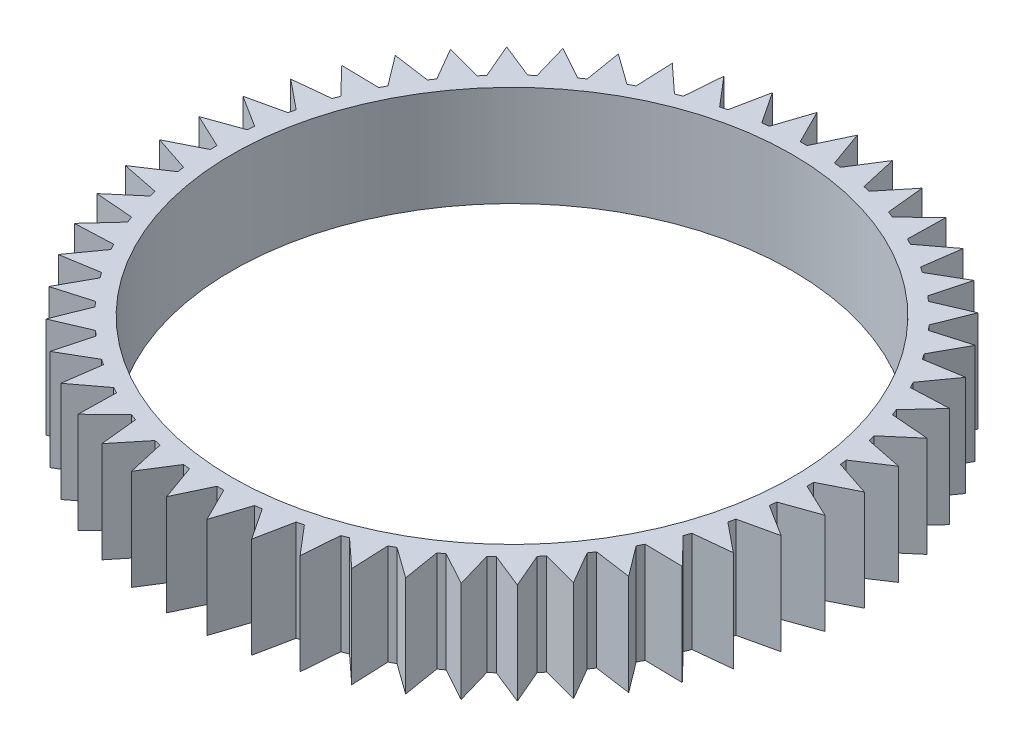
from build123d import *

# Parameters (mm, degrees)
SKETCH1_R           = 22.25
BOSS_EXTRUDE1_DEPTH = 8


with BuildPart() as part:
    # Sketch1 → Boss-Extrude1 (new body)
    with BuildSketch(Plane(origin=(0, 0, 0), x_dir=(1, 0, 0), z_dir=(0, 1, 0))):
        with BuildLine():
            Line((0, 23.45), (1.282365767, 26.162109518))
            Line((1.282365767, 26.162109518), (2.293347269, 23.337588957))
            ThreePointArc((2.293347269, 23.337588957), (2.560133686, 23.309830877), (2.826585152, 23.279023098))
            Line((2.826585152, 23.279023098), (4.426509707, 25.816786171))
            Line((4.426509707, 25.816786171), (5.089661683, 22.890999191))
            ThreePointArc((5.089661683, 22.890999191), (5.35115706, 22.83128595), (5.611952328, 22.768585619))
            Line((5.611952328, 22.768585619), (7.506105167, 25.094995948))
            Line((7.506105167, 25.094995948), (7.811757369, 22.110607111))
            ThreePointArc((7.811757369, 22.110607111), (8.064148514, 22.019809462), (8.315484601, 21.926130891))
            Line((8.315484601, 21.926130891), (10.476244712, 24.007264174))
            Line((10.476244712, 24.007264174), (10.419940042, 21.00779259))
            ThreePointArc((10.419940042, 21.00779259), (10.659546525, 20.887234568), (10.897758384, 20.763943802))
            Line((10.897758384, 20.763943802), (13.293617018, 22.56945243))
            Line((13.293617018, 22.56945243), (12.876176526, 19.598637148))
            ThreePointArc((12.876176526, 19.598637148), (13.099504343, 19.45007676), (13.321118311, 19.298971655))
            Line((13.321118311, 19.298971655), (15.917138454, 20.802527246))
            Line((15.917138454, 20.802527246), (15.144649361, 17.903689445))
            ThreePointArc((15.144649361, 17.903689445), (15.348441891, 17.729293035), (15.550226336, 17.552577045))
            Line((15.550226336, 17.552577045), (18.308552169, 18.732254373))
            Line((18.308552169, 18.732254373), (17.192279106, 15.947665633))
            ThreePointArc((17.192279106, 15.947665633), (17.373564595, 15.749976294), (17.552577045, 15.550226336))
            Line((17.552577045, 15.550226336), (20.432985966, 16.388823049))
            Line((20.432985966, 16.388823049), (18.989206708, 13.759088946))
            ThreePointArc((18.989206708, 13.759088946), (19.145341605, 13.540989434), (19.298971655, 13.321118311))
            Line((19.298971655, 13.321118311), (22.259460816, 13.806405781))
            Line((22.259460816, 13.806405781), (20.509228916, 11.369873759))
            ThreePointArc((20.509228916, 11.369873759), (20.637936422, 11.134544456), (20.763943802, 10.897758384))
            Line((20.763943802, 10.897758384), (23.761342604, 11.022660027))
            Line((23.761342604, 11.022660027), (21.730180383, 8.81486021))
            ThreePointArc((21.730180383, 8.81486021), (21.829583654, 8.565732746), (21.926130891, 8.315484601))
            Line((21.926130891, 8.315484601), (24.916730511, 8.078179069))
            Line((24.916730511, 8.078179069), (22.634256889, 6.131306149))
            ThreePointArc((22.634256889, 6.131306149), (22.702906401, 5.872013366), (22.768585619, 5.611952328))
            Line((22.768585619, 5.611952328), (25.708776379, 5.01590007))
            Line((25.708776379, 5.01590007), (23.208274961, 3.358343839))
            ThreePointArc((23.208274961, 3.358343839), (23.245169649, 3.092666807), (23.279023098, 2.826585152))
            Line((23.279023098, 2.826585152), (26.125930396, 1.880477953))
            Line((26.125930396, 1.880477953), (23.443864124, 0.536409313))
            ThreePointArc((23.443864124, 0.536409313), (23.448465981, 0.268222203), (23.45, 0))
            Line((23.45, 0), (26.162109518, -1.282365767))
            Line((26.162109518, -1.282365767), (23.337588957, -2.293347269))
            ThreePointArc((23.337588957, -2.293347269), (23.309830877, -2.560133686), (23.279023098, -2.826585152))
            Line((23.279023098, -2.826585152), (25.816786171, -4.426509707))
            Line((25.816786171, -4.426509707), (22.890999191, -5.089661683))
            ThreePointArc((22.890999191, -5.089661683), (22.83128595, -5.35115706), (22.768585619, -5.611952328))
            Line((22.768585619, -5.611952328), (25.094995948, -7.506105167))
            Line((25.094995948, -7.506105167), (22.110607111, -7.811757369))
            ThreePointArc((22.110607111, -7.811757369), (22.019809462, -8.064148514), (21.926130891, -8.315484601))
            Line((21.926130891, -8.315484601), (24.007264174, -10.476244712))
            Line((24.007264174, -10.476244712), (21.00779259, -10.419940042))
            ThreePointArc((21.00779259, -10.419940042), (20.887234568, -10.659546525), (20.763943802, -10.897758384))
            Line((20.763943802, -10.897758384), (22.56945243, -13.293617018))
            Line((22.56945243, -13.293617018), (19.598637148, -12.876176526))
            ThreePointArc((19.598637148, -12.876176526), (19.45007676, -13.099504343), (19.298971655, -13.321118311))
            Line((19.298971655, -13.321118311), (20.802527246, -15.917138454))
            Line((20.802527246, -15.917138454), (17.903689445, -15.144649361))
            ThreePointArc((17.903689445, -15.144649361), (17.729293035, -15.348441891), (17.552577045, -15.550226336))
            Line((17.552577045, -15.550226336), (18.732254373, -18.308552169))
            Line((18.732254373, -18.308552169), (15.947665633, -17.192279106))
            ThreePointArc((15.947665633, -17.192279106), (15.749976294, -17.373564595), (15.550226336, -17.552577045))
            Line((15.550226336, -17.552577045), (16.388823049, -20.432985966))
            Line((16.388823049, -20.432985966), (13.759088946, -18.989206708))
            ThreePointArc((13.759088946, -18.989206708), (13.540989434, -19.145341605), (13.321118311, -19.298971655))
            Line((13.321118311, -19.298971655), (13.806405781, -22.259460816))
            Line((13.806405781, -22.259460816), (11.369873759, -20.509228916))
            ThreePointArc((11.369873759, -20.509228916), (11.134544456, -20.637936422), (10.897758384, -20.763943802))
            Line((10.897758384, -20.763943802), (11.022660027, -23.761342604))
            Line((11.022660027, -23.761342604), (8.81486021, -21.730180383))
            ThreePointArc((8.81486021, -21.730180383), (8.565732746, -21.829583654), (8.315484601, -21.926130891))
            Line((8.315484601, -21.926130891), (8.078179069, -24.916730511))
            Line((8.078179069, -24.916730511), (6.131306149, -22.634256889))
            ThreePointArc((6.131306149, -22.634256889), (5.872013366, -22.702906401), (5.611952328, -22.768585619))
            Line((5.611952328, -22.768585619), (5.01590007, -25.708776379))
            Line((5.01590007, -25.708776379), (3.358343839, -23.208274961))
            ThreePointArc((3.358343839, -23.208274961), (3.092666807, -23.245169649), (2.826585152, -23.279023098))
            Line((2.826585152, -23.279023098), (1.880477953, -26.125930396))
            Line((1.880477953, -26.125930396), (0.536409313, -23.443864124))
            ThreePointArc((0.536409313, -23.443864124), (0.268222203, -23.448465981), (0, -23.45))
            Line((0, -23.45), (-1.282365767, -26.162109518))
            Line((-1.282365767, -26.162109518), (-2.293347269, -23.337588957))
            ThreePointArc((-2.293347269, -23.337588957), (-2.560133686, -23.309830877), (-2.826585152, -23.279023098))
            Line((-2.826585152, -23.279023098), (-4.426509707, -25.816786171))
            Line((-4.426509707, -25.816786171), (-5.089661683, -22.890999191))
            ThreePointArc((-5.089661683, -22.890999191), (-5.35115706, -22.83128595), (-5.611952328, -22.768585619))
            Line((-5.611952328, -22.768585619), (-7.506105167, -25.094995948))
            Line((-7.506105167, -25.094995948), (-7.811757369, -22.110607111))
            ThreePointArc((-7.811757369, -22.110607111), (-8.064148514, -22.019809462), (-8.315484601, -21.926130891))
            Line((-8.315484601, -21.926130891), (-10.476244712, -24.007264174))
            Line((-10.476244712, -24.007264174), (-10.419940042, -21.00779259))
            ThreePointArc((-10.419940042, -21.00779259), (-10.659546525, -20.887234568), (-10.897758384, -20.763943802))
            Line((-10.897758384, -20.763943802), (-13.293617018, -22.56945243))
            Line((-13.293617018, -22.56945243), (-12.876176526, -19.598637148))
            ThreePointArc((-12.876176526, -19.598637148), (-13.099504343, -19.45007676), (-13.321118311, -19.298971655))
            Line((-13.321118311, -19.298971655), (-15.917138454, -20.802527246))
            Line((-15.917138454, -20.802527246), (-15.144649361, -17.903689445))
            ThreePointArc((-15.144649361, -17.903689445), (-15.348441891, -17.729293035), (-15.550226336, -17.552577045))
            Line((-15.550226336, -17.552577045), (-18.308552169, -18.732254373))
            Line((-18.308552169, -18.732254373), (-17.192279106, -15.947665633))
            ThreePointArc((-17.192279106, -15.947665633), (-17.373564595, -15.749976294), (-17.552577045, -15.550226336))
            Line((-17.552577045, -15.550226336), (-20.432985966, -16.388823049))
            Line((-20.432985966, -16.388823049), (-18.989206708, -13.759088946))
            ThreePointArc((-18.989206708, -13.759088946), (-19.145341605, -13.540989434), (-19.298971655, -13.321118311))
            Line((-19.298971655, -13.321118311), (-22.259460816, -13.806405781))
            Line((-22.259460816, -13.806405781), (-20.509228916, -11.369873759))
            ThreePointArc((-20.509228916, -11.369873759), (-20.637936422, -11.134544456), (-20.763943802, -10.897758384))
            Line((-20.763943802, -10.897758384), (-23.761342604, -11.022660027))
            Line((-23.761342604, -11.022660027), (-21.730180383, -8.81486021))
            ThreePointArc((-21.730180383, -8.81486021), (-21.829583654, -8.565732746), (-21.926130891, -8.315484601))
            Line((-21.926130891, -8.315484601), (-24.916730511, -8.078179069))
            Line((-24.916730511, -8.078179069), (-22.634256889, -6.131306149))
            ThreePointArc((-22.634256889, -6.131306149), (-22.702906401, -5.872013366), (-22.768585619, -5.611952328))
            Line((-22.768585619, -5.611952328), (-25.708776379, -5.01590007))
            Line((-25.708776379, -5.01590007), (-23.208274961, -3.358343839))
            ThreePointArc((-23.208274961, -3.358343839), (-23.245169649, -3.092666807), (-23.279023098, -2.826585152))
            Line((-23.279023098, -2.826585152), (-26.125930396, -1.880477953))
            Line((-26.125930396, -1.880477953), (-23.443864124, -0.536409313))
            ThreePointArc((-23.443864124, -0.536409313), (-23.448465981, -0.268222203), (-23.45, 0))
            Line((-23.45, 0), (-26.162109518, 1.282365767))
            Line((-26.162109518, 1.282365767), (-23.337588957, 2.293347269))
            ThreePointArc((-23.337588957, 2.293347269), (-23.309830877, 2.560133686), (-23.279023098, 2.826585152))
            Line((-23.279023098, 2.826585152), (-25.816786171, 4.426509707))
            Line((-25.816786171, 4.426509707), (-22.890999191, 5.089661683))
            ThreePointArc((-22.890999191, 5.089661683), (-22.83128595, 5.35115706), (-22.768585619, 5.611952328))
            Line((-22.768585619, 5.611952328), (-25.094995948, 7.506105167))
            Line((-25.094995948, 7.506105167), (-22.110607111, 7.811757369))
            ThreePointArc((-22.110607111, 7.811757369), (-22.019809462, 8.064148514), (-21.926130891, 8.315484601))
            Line((-21.926130891, 8.315484601), (-24.007264174, 10.476244712))
            Line((-24.007264174, 10.476244712), (-21.00779259, 10.419940042))
            ThreePointArc((-21.00779259, 10.419940042), (-20.887234568, 10.659546525), (-20.763943802, 10.897758384))
            Line((-20.763943802, 10.897758384), (-22.56945243, 13.293617018))
            Line((-22.56945243, 13.293617018), (-19.598637148, 12.876176526))
            ThreePointArc((-19.598637148, 12.876176526), (-19.45007676, 13.099504343), (-19.298971655, 13.321118311))
            Line((-19.298971655, 13.321118311), (-20.802527246, 15.917138454))
            Line((-20.802527246, 15.917138454), (-17.903689445, 15.144649361))
            ThreePointArc((-17.903689445, 15.144649361), (-17.729293035, 15.348441891), (-17.552577045, 15.550226336))
            Line((-17.552577045, 15.550226336), (-18.732254373, 18.308552169))
            Line((-18.732254373, 18.308552169), (-15.947665633, 17.192279106))
            ThreePointArc((-15.947665633, 17.192279106), (-15.749976294, 17.373564595), (-15.550226336, 17.552577045))
            Line((-15.550226336, 17.552577045), (-16.388823049, 20.432985966))
            Line((-16.388823049, 20.432985966), (-13.759088946, 18.989206708))
            ThreePointArc((-13.759088946, 18.989206708), (-13.540989434, 19.145341605), (-13.321118311, 19.298971655))
            Line((-13.321118311, 19.298971655), (-13.806405781, 22.259460816))
            Line((-13.806405781, 22.259460816), (-11.369873759, 20.509228916))
            ThreePointArc((-11.369873759, 20.509228916), (-11.134544456, 20.637936422), (-10.897758384, 20.763943802))
            Line((-10.897758384, 20.763943802), (-11.022660027, 23.761342604))
            Line((-11.022660027, 23.761342604), (-8.81486021, 21.730180383))
            ThreePointArc((-8.81486021, 21.730180383), (-8.565732746, 21.829583654), (-8.315484601, 21.926130891))
            Line((-8.315484601, 21.926130891), (-8.078179069, 24.916730511))
            Line((-8.078179069, 24.916730511), (-6.131306149, 22.634256889))
            ThreePointArc((-6.131306149, 22.634256889), (-5.872013366, 22.702906401), (-5.611952328, 22.768585619))
            Line((-5.611952328, 22.768585619), (-5.01590007, 25.708776379))
            Line((-5.01590007, 25.708776379), (-3.358343839, 23.208274961))
            ThreePointArc((-3.358343839, 23.208274961), (-3.092666807, 23.245169649), (-2.826585152, 23.279023098))
            Line((-2.826585152, 23.279023098), (-1.880477953, 26.125930396))
            Line((-1.880477953, 26.125930396), (-0.536409313, 23.443864124))
            ThreePointArc((-0.536409313, 23.443864124), (-0.268222203, 23.448465981), (0, 23.45))
        make_face()
        with Locations(Location((0, 0, 0), (0, 0, 270))):
            Circle(SKETCH1_R, mode=Mode.SUBTRACT)
    extrude(amount=BOSS_EXTRUDE1_DEPTH)


solid = part.part
